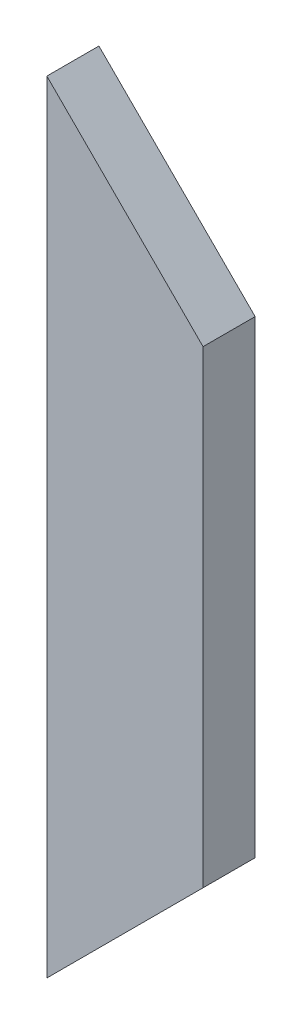
from build123d import *

# Parameters (mm, degrees)
SKETCH1_W           = 76.2
SKETCH1_H           = 381
BOSS_EXTRUDE1_DEPTH = 25.4
CUT_EXTRUDE1_DEPTH  = 25.4


with BuildPart() as part:
    # Sketch1 → Boss-Extrude1 (new body)
    with BuildSketch(Plane.XY):
        Rectangle(SKETCH1_W, SKETCH1_H)
    extrude(amount=BOSS_EXTRUDE1_DEPTH)

    # Sketch2 → Cut-Extrude1 (cut)
    with BuildSketch(Plane.XY.offset(25.4)):
        Polygon((-38.1, 190.5), (38.1, 114.3), (38.1, 190.5), align=None)
        Polygon((-38.1, -190.5), (38.1, -114.3), (38.1, -190.5), align=None)
    extrude(amount=-CUT_EXTRUDE1_DEPTH, mode=Mode.SUBTRACT)


solid = part.part
